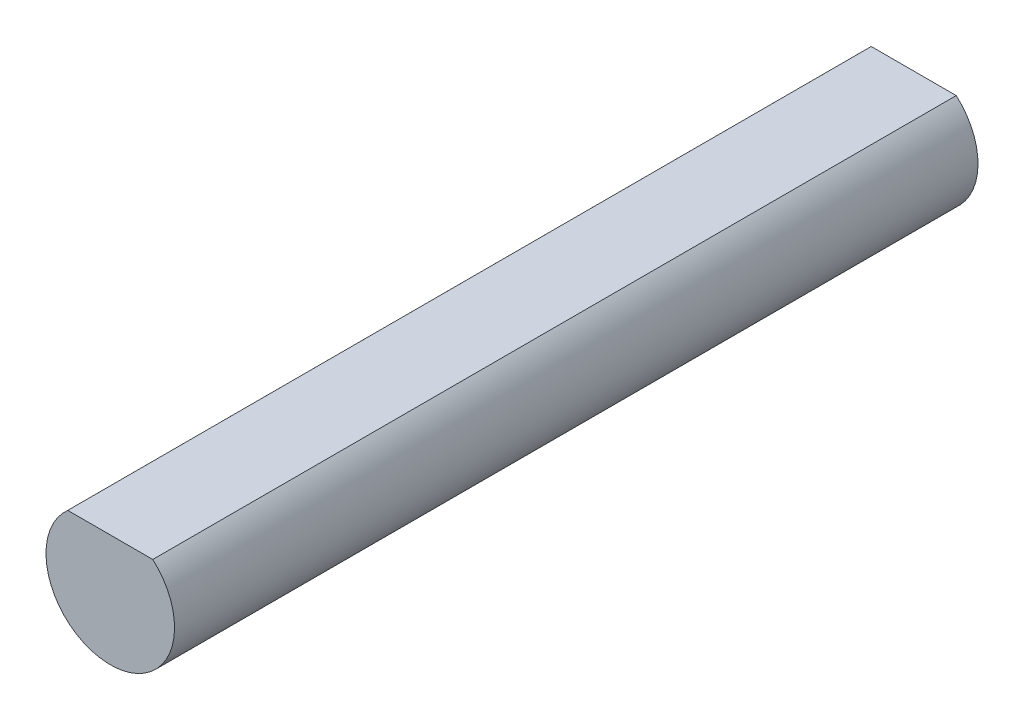
from build123d import *

# Parameters (mm, degrees)
BOSS_EXTRUDE1_DEPTH = 25


with BuildPart() as part:
    # Sketch1 → Boss-Extrude1 (new body)
    with BuildSketch(Plane.XY):
        with BuildLine():
            Line((1.322875656, 1.5), (-1.322875656, 1.5))
            ThreePointArc((-1.322875656, 1.5), (0, -2), (1.322875656, 1.5))
        make_face()
    extrude(amount=BOSS_EXTRUDE1_DEPTH)


solid = part.part
